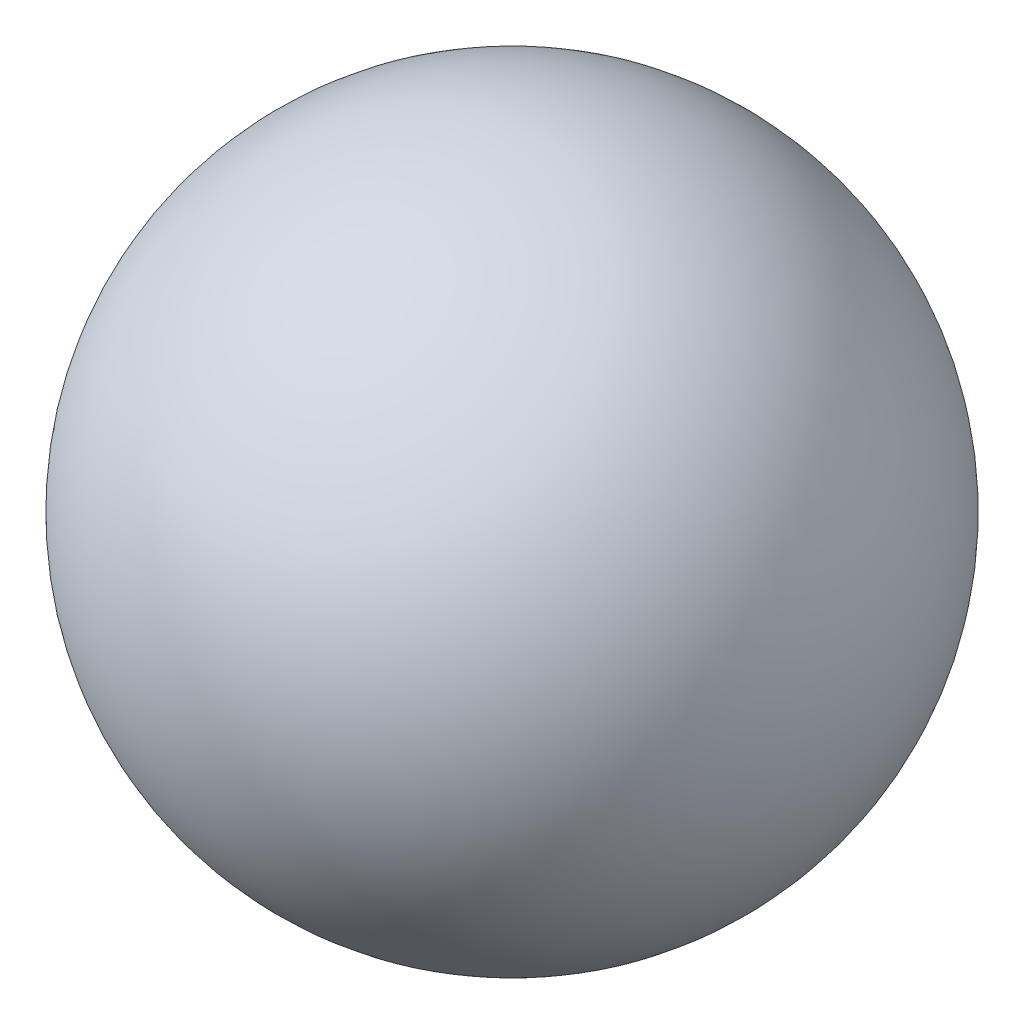
from build123d import *


with BuildPart() as part:
    # Croquis1 → Revolución1 (revolve)
    with BuildSketch(Plane(origin=(0, 0, 0), x_dir=(0, 0, -1), z_dir=(1, 0, 0))):
        with BuildLine():
            Line((0, -8.15), (0, 8.15))
            ThreePointArc((0, 8.15), (-8.15, 0), (0, -8.15))
        make_face()
    revolve(axis=Axis((0, -8.15, 0), (0, 1, 0)))


solid = part.part
